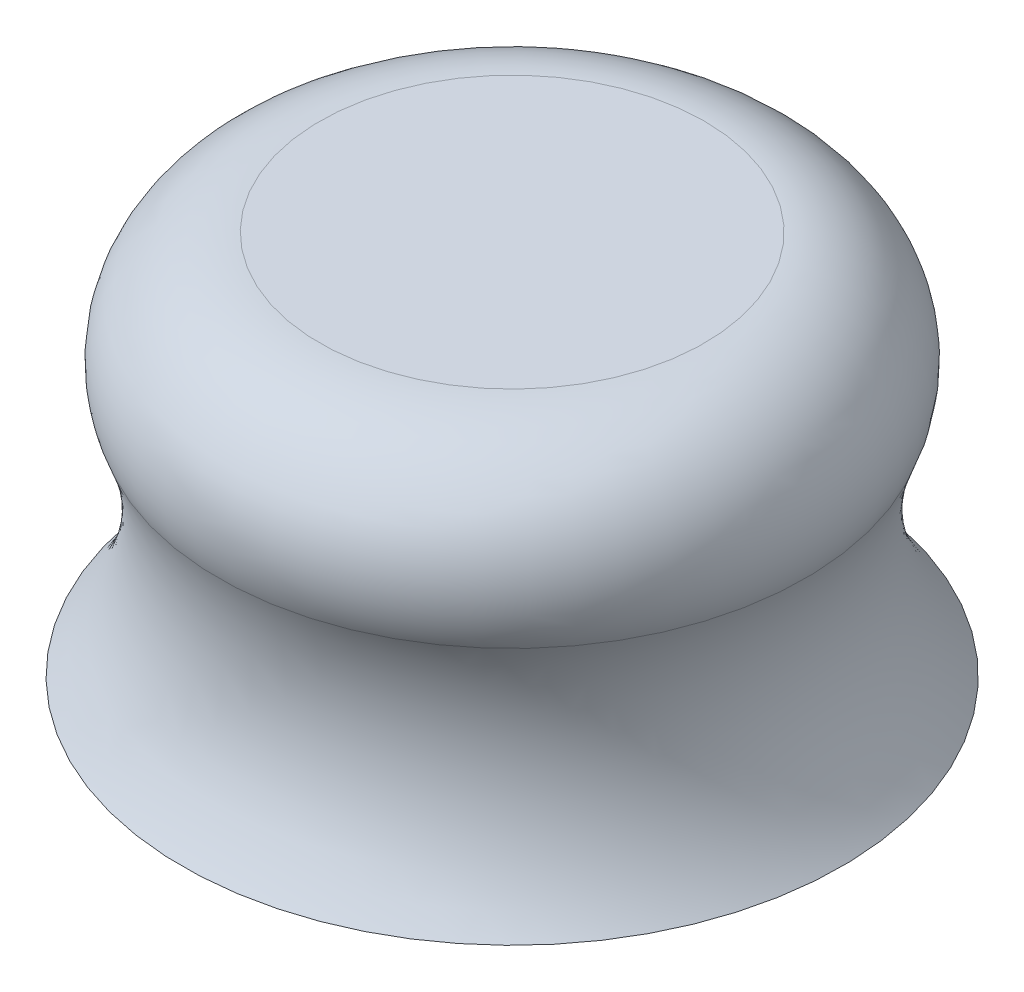
from build123d import *


with BuildPart() as part:
    # Sketch1 → Revolve1 (revolve)
    with BuildSketch(Plane(origin=(0, 0, 0), x_dir=(0, 0, -1), z_dir=(1, 0, 0))):
        with BuildLine():
            Line((0, 0), (0, 35))
            Line((0, 35), (17.5, 35))
            ThreePointArc((17.5, 35), (25.85098349, 30.501006703), (26.687763231, 21.052214949))
            ThreePointArc((26.687763231, 21.052214949), (25.306327755, 10.048195881), (30, 0))
            Line((30, 0), (0, 0))
        make_face()
    revolve(axis=Axis((0, 0, 0), (0, 1, 0)))


solid = part.part
